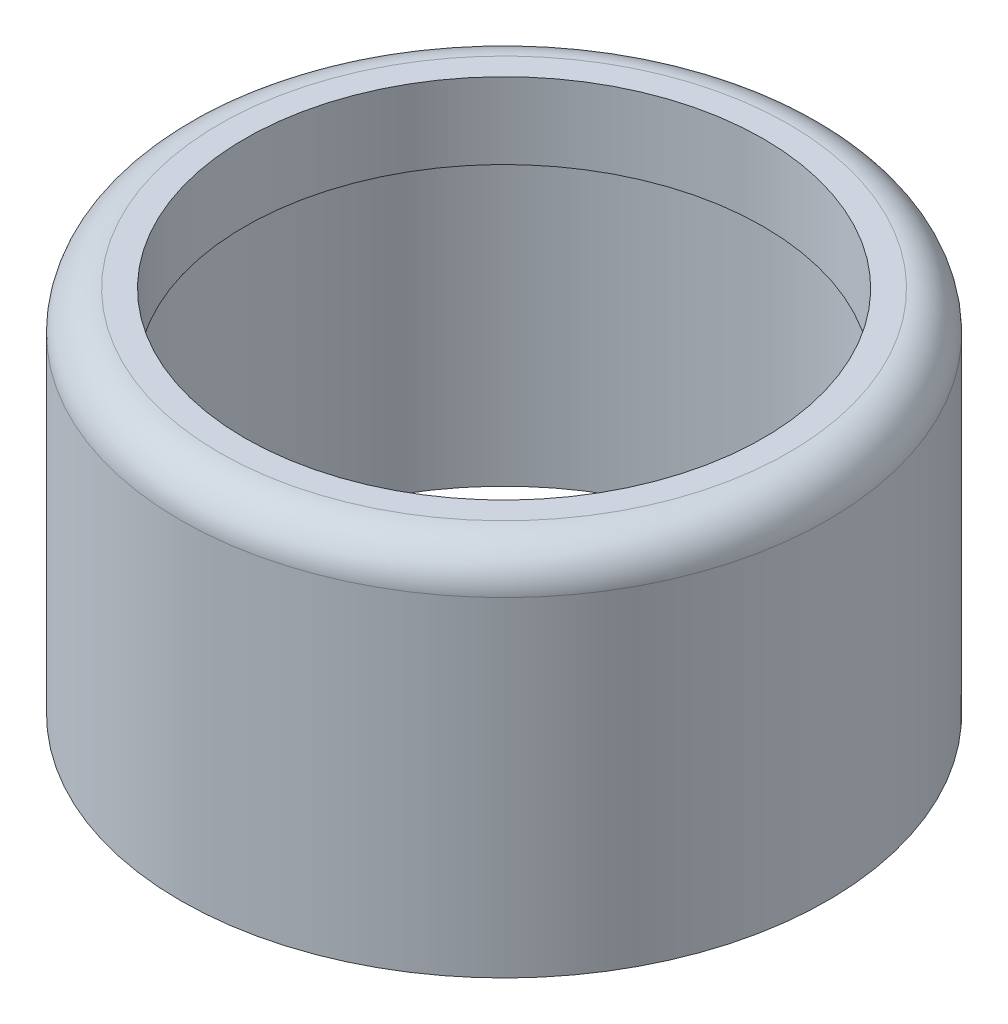
from build123d import *


with BuildPart() as part:
    # Sketch1 → Revolve1 (revolve)
    with BuildSketch(Plane.XY, mode=Mode.PRIVATE) as revolve1_sk:
        with BuildLine():
            Line((14.3, -19.862439096), (14.3, -4.862439096))
            Line((14.3, -4.862439096), (13.3, -4.862439096))
            Line((13.3, -4.862439096), (13.3, -0.962439096))
            Line((13.3, -0.962439096), (14.6, -0.962439096))
            ThreePointArc((14.6, -0.962439096), (16.014213562, -1.548225533), (16.6, -2.962439096))
            Line((16.6, -2.962439096), (16.6, -19.862439096))
            Line((16.6, -19.862439096), (14.3, -19.862439096))
        make_face()
    revolve(revolve1_sk.sketch.rotate(Axis((0, 0, 0), (0, -1, 0)), 90), axis=Axis((0, 0, 0), (0, -1, 0)))


solid = part.part
